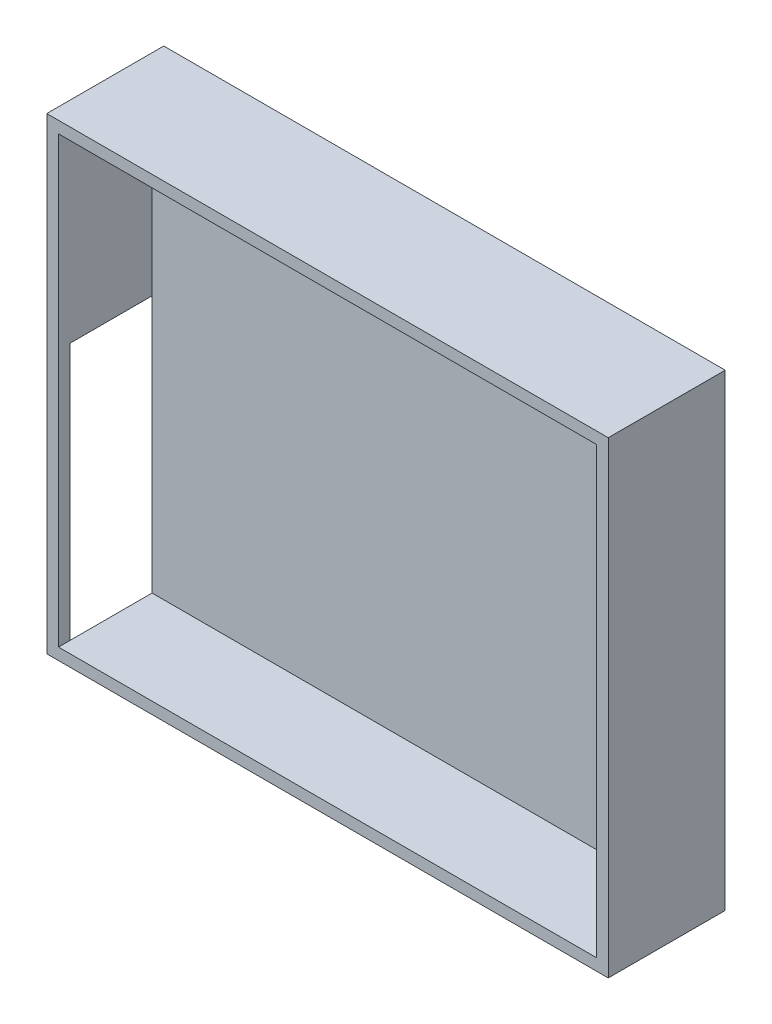
from build123d import *

# Parameters (mm, degrees)
SKETCH2_W           = 120
SKETCH2_H           = 100
BOSS_EXTRUDE1_DEPTH = 25
SKETCH3_W           = 115
SKETCH3_H           = 95
CUT_EXTRUDE1_DEPTH  = 20
SKETCH4_W           = 20
SKETCH4_H           = 60
CUT_EXTRUDE2_DEPTH  = 2.5


with BuildPart() as part:
    # Sketch2 → Boss-Extrude1 (new body)
    with BuildSketch(Plane.XY):
        Rectangle(SKETCH2_W, SKETCH2_H)
    extrude(amount=BOSS_EXTRUDE1_DEPTH)

    # Sketch3 → Cut-Extrude1 (cut)
    with BuildSketch(Plane.XY.offset(25)):
        Rectangle(SKETCH3_W, SKETCH3_H)
    extrude(amount=-CUT_EXTRUDE1_DEPTH, mode=Mode.SUBTRACT)

    # Sketch4 → Cut-Extrude2 (cut)
    with BuildSketch(Plane.ZY.offset(60)):
        with Locations((12.5, -22.5)):
            Rectangle(SKETCH4_W, SKETCH4_H)
    extrude(amount=-CUT_EXTRUDE2_DEPTH, mode=Mode.SUBTRACT)


solid = part.part
